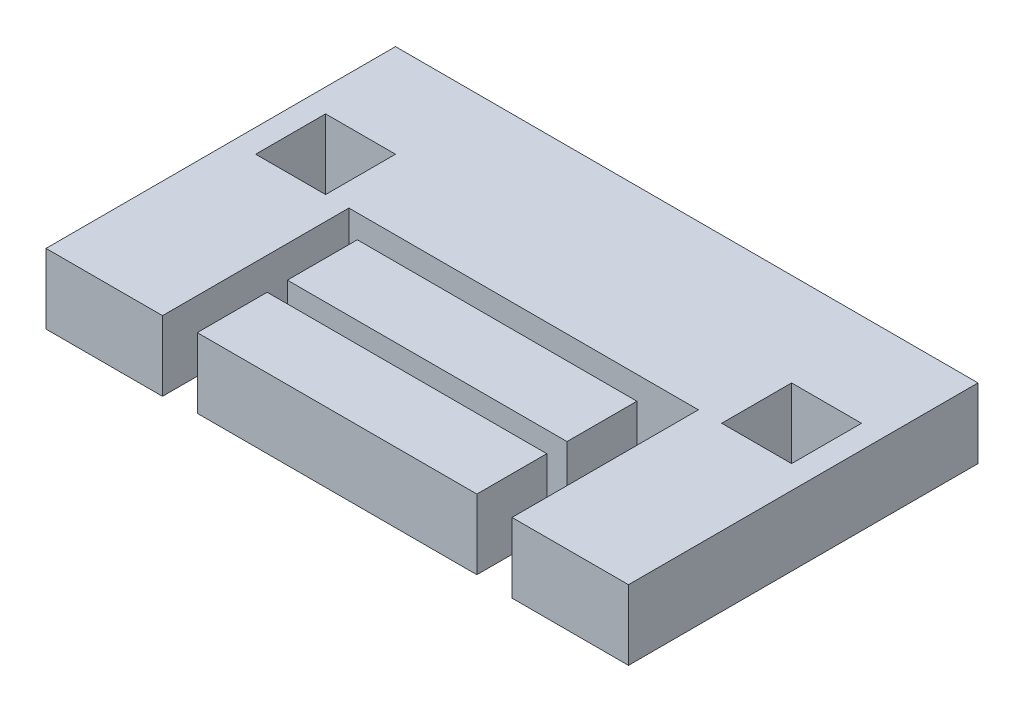
from build123d import *

# Parameters (mm, degrees)
SKETCH1_W             = 3
SKETCH1_H             = 3
BOSS_EXTRUDE1_DEPTH   = 3
SKETCH1_W_2           = 12
BOSS_EXTRUDE1_2_DEPTH = 3
BOSS_EXTRUDE1_3_DEPTH = 3


with BuildPart() as part:
    # Sketch1 → Boss-Extrude1 (new body)
    with BuildSketch(Plane(origin=(0, 0, 0), x_dir=(1, 0, 0), z_dir=(0, 1, 0))):
        Polygon((-18.803797147, 19.591775352), (-18.803797147, 4.591775352), (-13.803797147, 4.591775352), (-13.803797147, 12.591775352), (1.196202853, 12.591775352), (1.196202853, 4.591775352), (6.196202853, 4.591775352), (6.196202853, 19.591775352), align=None)
        with Locations((-16.303797147, 14.091775352)):
            Rectangle(SKETCH1_W, SKETCH1_H, mode=Mode.SUBTRACT)
        with Locations((3.696202853, 14.091775352)):
            Rectangle(SKETCH1_W, SKETCH1_H, mode=Mode.SUBTRACT)
    extrude(amount=BOSS_EXTRUDE1_DEPTH)


with BuildPart() as body_2:
    # Sketch1 → Boss-Extrude1 2 (new body)
    with BuildSketch(Plane(origin=(0, 0, 0), x_dir=(1, 0, 0), z_dir=(0, 1, 0))):
        with Locations((-6.427005905, 6.207154299)):
            Rectangle(SKETCH1_W_2, SKETCH1_H)
    extrude(amount=BOSS_EXTRUDE1_2_DEPTH)


with BuildPart() as body_3:
    # Sketch1 → Boss-Extrude1 3 (new body)
    with BuildSketch(Plane(origin=(0, 0, 0), x_dir=(1, 0, 0), z_dir=(0, 1, 0))):
        with Locations((-6.443434318, 10.091775352)):
            Rectangle(SKETCH1_W_2, SKETCH1_H)
    extrude(amount=BOSS_EXTRUDE1_3_DEPTH)


solid = Compound([part.part, body_2.part, body_3.part])
